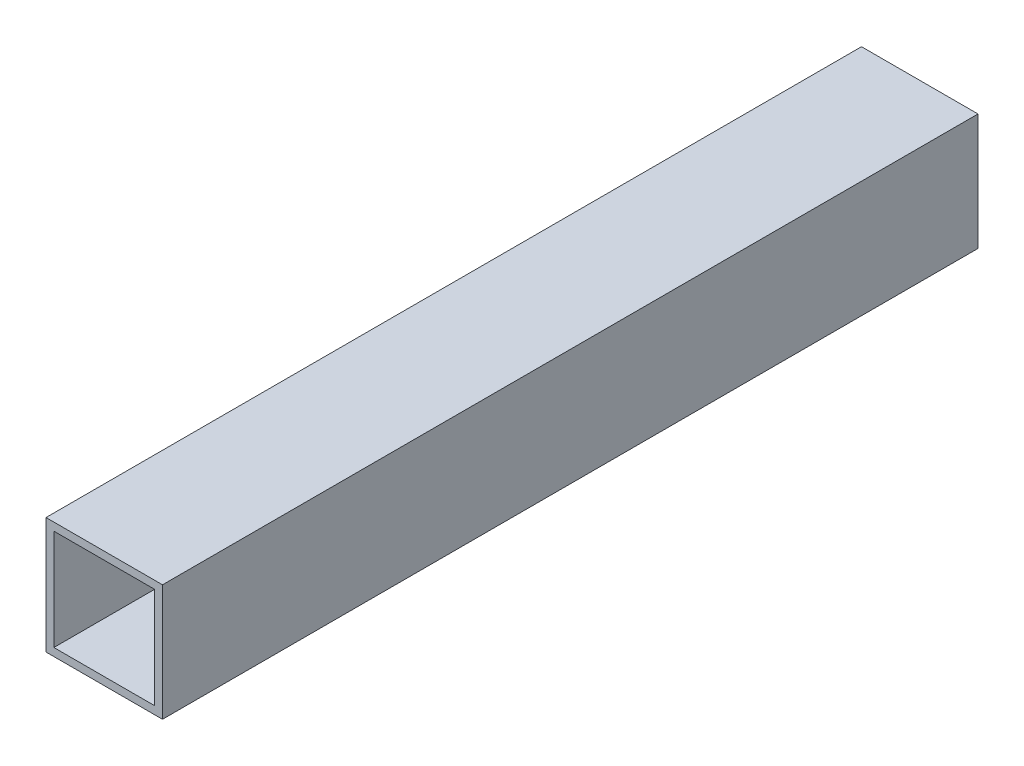
from build123d import *

# Parameters (mm, degrees)
SKETCH1_W           = 25.4
SKETCH1_H           = 25.4
SKETCH1_W_2         = 21.971
SKETCH1_H_2         = 21.971
BOSS_EXTRUDE1_DEPTH = 88.9


with BuildPart() as part:
    # Sketch1 → Boss-Extrude1 (new, symmetric)
    with BuildSketch(Plane.XY):
        Rectangle(SKETCH1_W, SKETCH1_H)
        Rectangle(SKETCH1_W_2, SKETCH1_H_2, mode=Mode.SUBTRACT)
    extrude(amount=BOSS_EXTRUDE1_DEPTH, both=True)


solid = part.part
